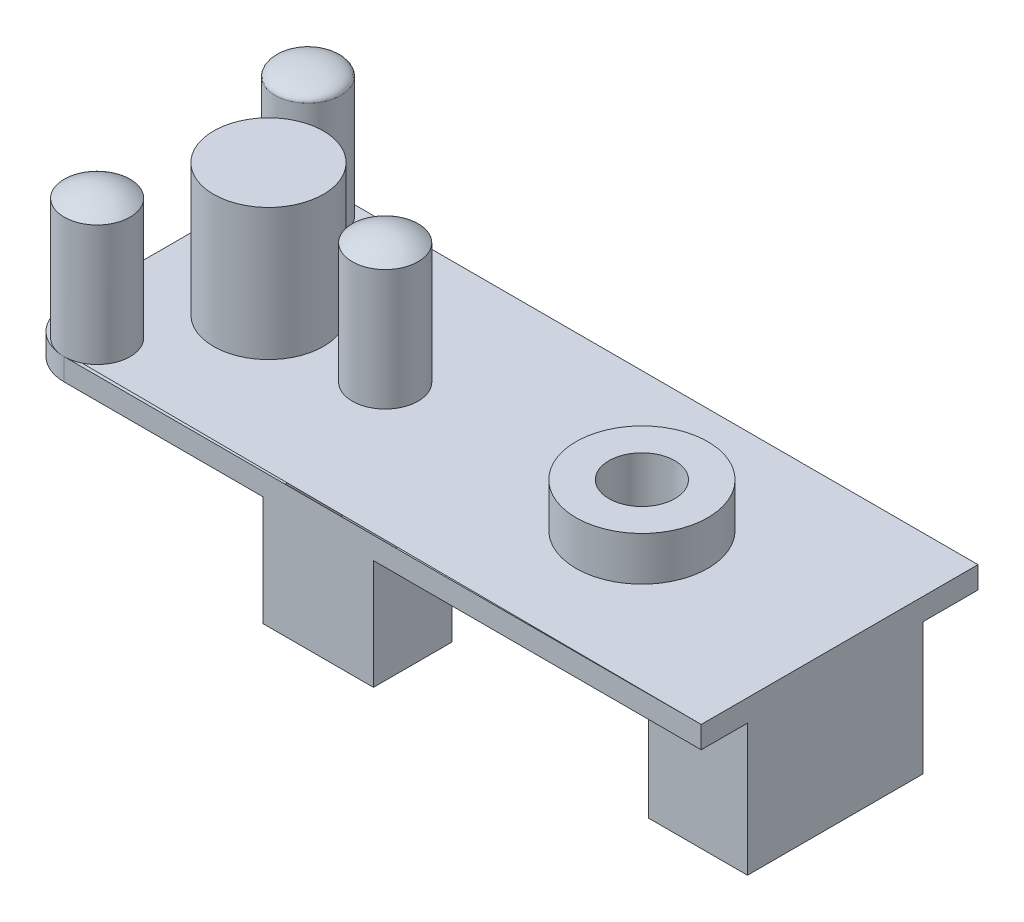
from build123d import *

# Parameters (mm, degrees)
SKETCH_1_W          = 31
SKETCH_1_H          = 12.6
EXTRUDE_1_DEPTH     = 1
SKETCH_2_R          = 2.5
EXTRUDE_2_DEPTH     = 6
SKETCH_3_R          = 1.5
EXTRUDE_3_DEPTH     = 5.5
DOME_1_FACE_RADIUS  = 1.5
DOME_1_HEIGHT       = 0.5
DOME_2_FACE_RADIUS  = 1.5
DOME_2_HEIGHT       = 0.5
DOME_3_FACE_RADIUS  = 1.5
DOME_3_HEIGHT       = 0.5
SKETCH_4_R          = 1.5
CUT_EXTRUDE_1_DEPTH = 18.774701192
EXTRUDE_START       = 2
SKETCH_5_R          = 3
SKETCH_5_R_2        = 1.5
EXTRUDE_4_DEPTH     = 2
SKETCH_6_W          = 4.5
SKETCH_6_H          = 8
EXTRUDE_6_DEPTH     = 6
SKETCH_7_W          = 3.38323666
SKETCH_7_H          = 6.498483094
CUT_EXTRUDE_2_DEPTH = 5
FILLET_1_R          = 2
SKETCH_9_W          = 5.019385781
SKETCH_9_H          = 3.581166035
EXTRUDE_7_DEPTH     = 5


with BuildPart() as part:
    # 草图1 → 凸台-拉伸1 (new body)
    with BuildSketch(Plane(origin=(0, 0, 0), x_dir=(1, 0, 0), z_dir=(0, 1, 0))):
        Rectangle(SKETCH_1_W, SKETCH_1_H)
    extrude(amount=EXTRUDE_1_DEPTH)

    # 草图2 → 凸台-拉伸2 (add)
    with BuildSketch(Plane(origin=(0, 1, 0), x_dir=(1, 0, 0), z_dir=(0, 1, 0))):
        with Locations(Location((-10.5, 0, 0), (0, 0, 270))):
            Circle(SKETCH_2_R)
    extrude(amount=EXTRUDE_2_DEPTH)

    # 草图3 → 凸台-拉伸3 (add)
    with BuildSketch(Plane(origin=(0, 1, 0), x_dir=(1, 0, 0), z_dir=(0, 1, 0))):
        with Locations(Location((-13.5, -4.8, 0), (0, 0, 270))):
            Circle(SKETCH_3_R)
        with Locations(Location((-13.5, 4.8, 0), (0, 0, 90))):
            Circle(SKETCH_3_R)
        with Locations(Location((-5.186156124, 0, 0), (0, 0, 270))):
            Circle(SKETCH_3_R)
    extrude(amount=EXTRUDE_3_DEPTH)

    # 圆顶1: an elliptical dome of height H over a round flat face of radius A is half a spheroid: the quarter ellipse of half axes A and H revolved about the face's axis
    with BuildSketch(Plane((-13.5, 6.5, -4.8), x_dir=(0, 0, -1), z_dir=(1, 0, 0)), mode=Mode.PRIVATE) as dome_1_quarter:
        Ellipse(DOME_1_FACE_RADIUS, DOME_1_HEIGHT)
        Rectangle(DOME_1_FACE_RADIUS, DOME_1_HEIGHT, align=(Align.MIN, Align.MIN), mode=Mode.INTERSECT)
    revolve(dome_1_quarter.sketch, axis=Axis((-13.5, 6.5, -4.8), (0, 1, 0)))

    # 圆顶2: a dome of height H over a round flat face of radius A is a cap of a sphere of radius (A * A + H * H) / (2 * H)
    dome_2_r = (DOME_2_FACE_RADIUS * DOME_2_FACE_RADIUS + DOME_2_HEIGHT * DOME_2_HEIGHT) / (2 * DOME_2_HEIGHT)
    dome_2_base = Plane((-13.5, 6.5, 4.8), z_dir=(0, 1, 0))
    with Locations(dome_2_base.offset(DOME_2_HEIGHT - dome_2_r)):
        dome_2_ball = Sphere(dome_2_r, mode=Mode.PRIVATE)
    add(split(dome_2_ball, bisect_by=dome_2_base, keep=Keep.TOP, mode=Mode.PRIVATE))

    # 圆顶3: a dome of height H over a round flat face of radius A is a cap of a sphere of radius (A * A + H * H) / (2 * H)
    dome_3_r = (DOME_3_FACE_RADIUS * DOME_3_FACE_RADIUS + DOME_3_HEIGHT * DOME_3_HEIGHT) / (2 * DOME_3_HEIGHT)
    dome_3_base = Plane((-5.186156124, 6.5, 0), z_dir=(0, 1, 0))
    with Locations(dome_3_base.offset(DOME_3_HEIGHT - dome_3_r)):
        dome_3_ball = Sphere(dome_3_r, mode=Mode.PRIVATE)
    add(split(dome_3_ball, bisect_by=dome_3_base, keep=Keep.TOP, mode=Mode.PRIVATE))

    # 草图4 → 切除-拉伸1 (cut, through all)
    with BuildSketch(Plane(origin=(0, 1, 0), x_dir=(1, 0, 0), z_dir=(0, 1, 0))):
        with Locations(Location((6.5, 0, 0), (0, 0, 270))):
            Circle(SKETCH_4_R)
    extrude(amount=-CUT_EXTRUDE_1_DEPTH, mode=Mode.SUBTRACT)

    # 草图5 → 凸台-拉伸4 (add)
    with BuildSketch(Plane(origin=(0, 1, 0), x_dir=(1, 0, 0), z_dir=(0, 1, 0)).offset(EXTRUDE_START)):
        with Locations(Location((6.5, 0, 0), (0, 0, 270))):
            Circle(SKETCH_5_R)
        with Locations(Location((6.5, 0, 0), (0, 0, 270))):
            Circle(SKETCH_5_R_2, mode=Mode.SUBTRACT)
    extrude(amount=-EXTRUDE_4_DEPTH)

    # 草图6 → 凸台-拉伸6 (add)
    with BuildSketch(Plane(origin=(0, 0, 0), x_dir=(-1, 0, 0), z_dir=(0, -1, 0))):
        with Locations((-13.25, -0.193431005)):
            Rectangle(SKETCH_6_W, SKETCH_6_H)
    extrude(amount=EXTRUDE_6_DEPTH)

    # 草图7 → 切除-拉伸2 (cut)
    with BuildSketch(Plane.XZ.offset(6)):
        with Locations((13.25, 0.193431005)):
            Rectangle(SKETCH_7_W, SKETCH_7_H)
    extrude(amount=-CUT_EXTRUDE_2_DEPTH, mode=Mode.SUBTRACT)

    # 圆角1
    fillet_1_edges = [part.edges().sort_by_distance(p)[0] for p in [
        (-15.5, 0.5, -6.3),
        (-15.5, 0.5, 6.3),
    ]]
    fillet(fillet_1_edges, radius=FILLET_1_R)

    # 草图9 → 凸台-拉伸7 (add)
    with BuildSketch(Plane.XZ):
        with Locations((-1.930507992, 4.509416983)):
            Rectangle(SKETCH_9_W, SKETCH_9_H)
    extrude(amount=EXTRUDE_7_DEPTH)


solid = part.part
